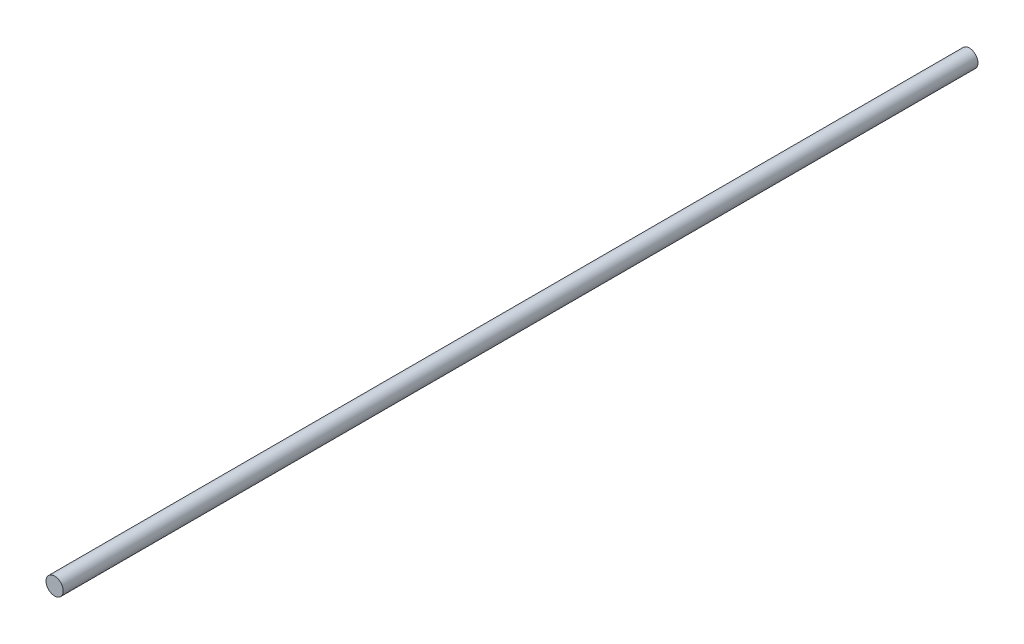
from build123d import *

# Parameters (mm, degrees)
SKETCH_1_R      = 10
EXTRUDE_1_DEPTH = 530


with BuildPart() as part:
    # 草图1 → 凸台-拉伸1 (new, symmetric)
    with BuildSketch(Plane.XY):
        Circle(SKETCH_1_R)
    extrude(amount=EXTRUDE_1_DEPTH, both=True)


solid = part.part
